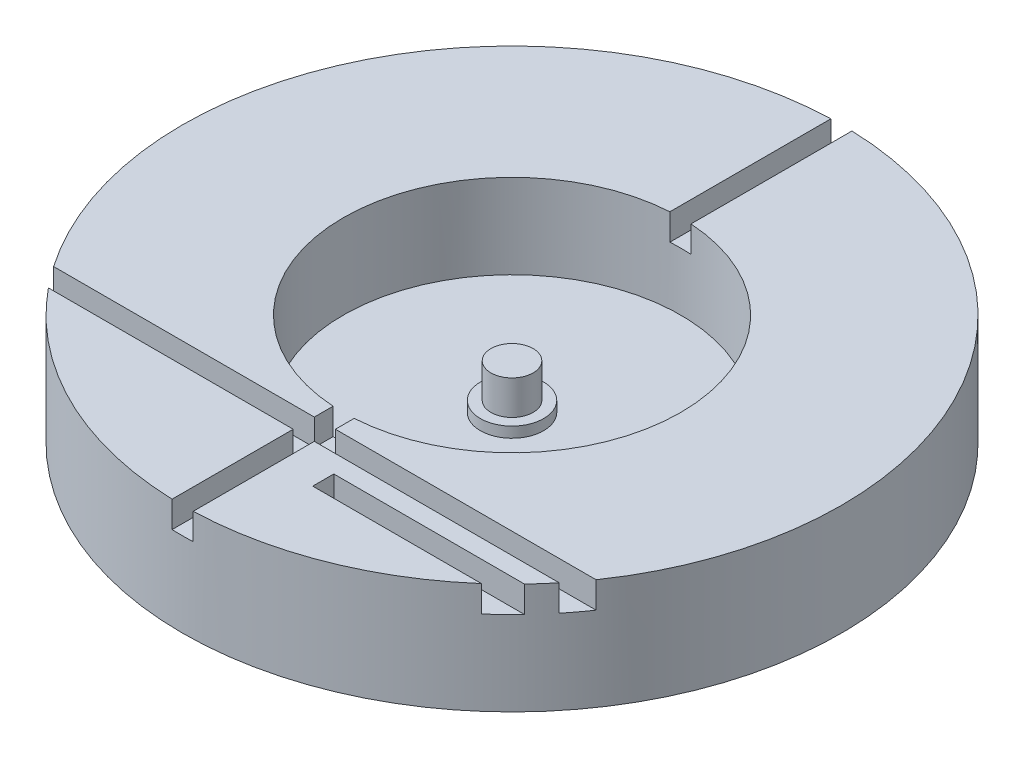
from build123d import *

# Parameters (mm, degrees)
SKETCH1_R           = 62.5
BOSS_EXTRUDE1_DEPTH = 21
SKETCH2_R           = 32
SKETCH2_R_2         = 6
CUT_EXTRUDE1_DEPTH  = 16
SKETCH3_R           = 6
SKETCH3_R_2         = 4
CUT_EXTRUDE2_DEPTH  = 14
SKETCH4_R           = 4
CUT_EXTRUDE3_DEPTH  = 7.5
CUT_EXTRUDE4_START  = -5
CUT_EXTRUDE4_DEPTH  = 5
CUT_EXTRUDE5_START  = -5
CUT_EXTRUDE5_DEPTH  = 5
CUT_EXTRUDE6_START  = -5
CUT_EXTRUDE6_DEPTH  = 5


with BuildPart() as part:
    # Sketch1 → Boss-Extrude1 (new body)
    with BuildSketch(Plane(origin=(0, 0, 0), x_dir=(1, 0, 0), z_dir=(0, 1, 0))):
        with Locations(Location((0, 0, 0), (0, 0, 90))):
            Circle(SKETCH1_R)
    extrude(amount=BOSS_EXTRUDE1_DEPTH)

    # Sketch2 → Cut-Extrude1 (cut)
    with BuildSketch(Plane(origin=(0, 21, 0), x_dir=(1, 0, 0), z_dir=(0, 1, 0))):
        with Locations(Location((0, 0, 0), (0, 0, 270))):
            Circle(SKETCH2_R)
        with Locations(Location((0, 0, 0), (0, 0, 270))):
            Circle(SKETCH2_R_2, mode=Mode.SUBTRACT)
    extrude(amount=-CUT_EXTRUDE1_DEPTH, mode=Mode.SUBTRACT)

    # Sketch3 → Cut-Extrude2 (cut)
    with BuildSketch(Plane(origin=(0, 21, 0), x_dir=(1, 0, 0), z_dir=(0, 1, 0))):
        with Locations(Location((0, 0, 0), (0, 0, 270))):
            Circle(SKETCH3_R)
        with Locations(Location((0, 0, 0), (0, 0, 270))):
            Circle(SKETCH3_R_2, mode=Mode.SUBTRACT)
    extrude(amount=-CUT_EXTRUDE2_DEPTH, mode=Mode.SUBTRACT)

    # Sketch4 → Cut-Extrude3 (cut)
    with BuildSketch(Plane(origin=(0, 21, 0), x_dir=(1, 0, 0), z_dir=(0, 1, 0))):
        with Locations(Location((0, 0, 0), (0, 0, 270))):
            Circle(SKETCH4_R)
    extrude(amount=-CUT_EXTRUDE3_DEPTH, mode=Mode.SUBTRACT)

    # Sketch5 → Cut-Extrude4 (cut)
    with BuildSketch(Plane(origin=(0, 21, 0), x_dir=(1, 0, 0), z_dir=(0, 1, 0)).offset(CUT_EXTRUDE4_START)):
        with BuildLine():
            Line((2, 62.467991804), (2, -62.467991804))
            ThreePointArc((2, -62.467991804), (0, -62.5), (-2, -62.467991804))
            Line((-2, -62.467991804), (-2, 62.467991804))
            ThreePointArc((-2, 62.467991804), (0, 62.5), (2, 62.467991804))
        make_face()
    extrude(amount=CUT_EXTRUDE4_DEPTH, mode=Mode.SUBTRACT)

    # Sketch6 → Cut-Extrude5 (cut)
    with BuildSketch(Plane(origin=(0, 21, 0), x_dir=(1, 0, 0), z_dir=(0, 1, 0)).offset(CUT_EXTRUDE5_START)):
        with BuildLine():
            Line((-48.435524153, -39.5), (48.435524153, -39.5))
            ThreePointArc((48.435524153, -39.5), (49.977438468, -37.530063205), (51.439284598, -35.5))
            Line((51.439284598, -35.5), (-51.439284598, -35.5))
            ThreePointArc((-51.439284598, -35.5), (-49.977438468, -37.530063205), (-48.435524153, -39.5))
        make_face()
    extrude(amount=CUT_EXTRUDE5_DEPTH, mode=Mode.SUBTRACT)

    # Sketch9 → Cut-Extrude6 (cut)
    with BuildSketch(Plane(origin=(0, 21, 0), x_dir=(1, 0, 0), z_dir=(0, 1, 0)).offset(CUT_EXTRUDE6_START)):
        with BuildLine():
            Line((41.19769411, -43), (45.356917885, -43))
            ThreePointArc((45.356917885, -43), (43.323494947, -45.048027544), (41.19769411, -47))
            Line((41.19769411, -47), (9.19769411, -47))
            Line((9.19769411, -47), (9.19769411, -43))
            Line((9.19769411, -43), (41.19769411, -43))
        make_face()
    extrude(amount=CUT_EXTRUDE6_DEPTH, mode=Mode.SUBTRACT)


solid = part.part
